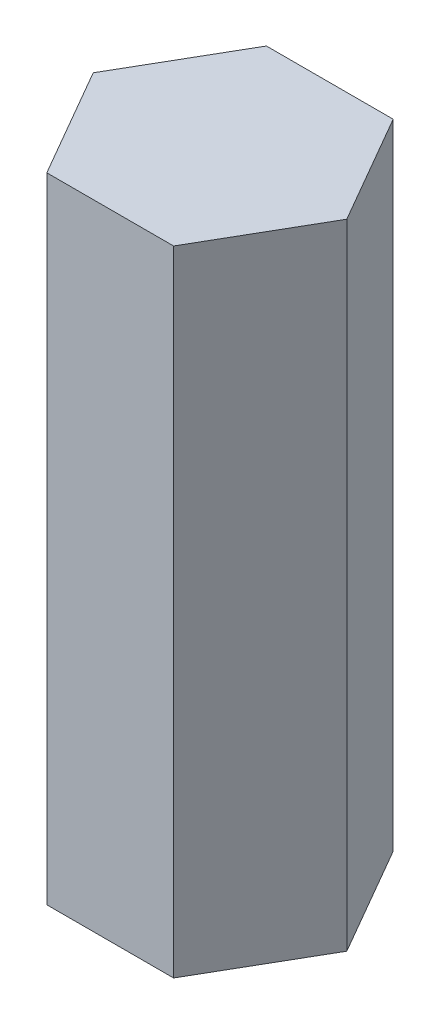
from build123d import *

# Parameters (mm, degrees)
EXTRUDE_1_DEPTH = 75


with BuildPart() as part:
    # 草图1 → 凸台-拉伸1 (new body)
    with BuildSketch(Plane(origin=(0, 0, 0), x_dir=(1, 0, 0), z_dir=(0, 1, 0))):
        Polygon((15, 0), (7.5, 12.990381057), (-7.5, 12.990381057), (-15, 0), (-7.5, -12.990381057), (7.5, -12.990381057), align=None)
    extrude(amount=EXTRUDE_1_DEPTH)


solid = part.part
